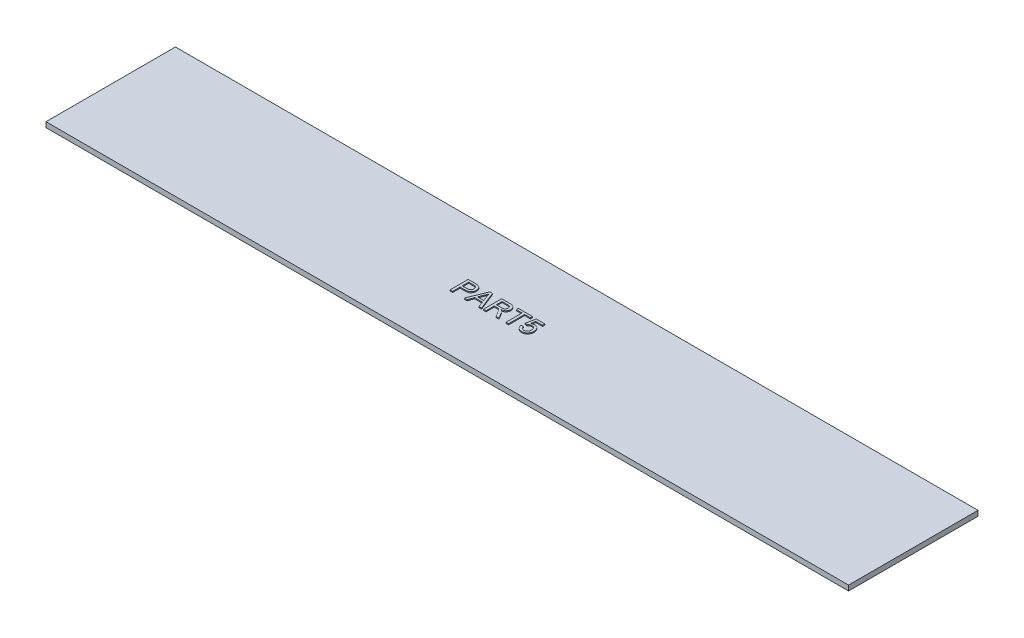
from build123d import *

# Parameters (mm, degrees)
SKETCH_1_W      = 155
SKETCH_1_H      = 25
EXTRUDE_1_DEPTH = 1
EXTRUDE_2_DEPTH = 0.2


with BuildPart() as part:
    # 草图1 → 凸台-拉伸1 (new body)
    with BuildSketch(Plane(origin=(0, 0, 0), x_dir=(1, 0, 0), z_dir=(0, 1, 0))):
        with Locations((77.5, 12.5)):
            Rectangle(SKETCH_1_W, SKETCH_1_H)
    extrude(amount=EXTRUDE_1_DEPTH)

    # 草图2 → 凸台-拉伸2 (add)
    # profile 1 of 5: a face of its own
    with BuildSketch(Plane(origin=(0, 1, 0), x_dir=(1, 0, 0), z_dir=(0, 1, 0))):
        with BuildLine():
            Line((67.347806696, 10.693449152), (67.347806696, 14.193449152))
            Line((67.347806696, 14.193449152), (68.633664068, 14.193449152))
            add(Edge.make_bspline(
                [(68.633664068, 14.193449152), (68.68696182, 14.19314551), (68.787055247, 14.19257527), (68.926834433, 14.185897021), (69.046865089, 14.177634922), (69.119364088, 14.165871841), (69.152494196, 14.160496427)],
                knots=[0, 0, 0, 0, 1.22865052, 2.30741144, 3.226532197, 4, 4, 4, 4], degree=3))
            add(Edge.make_bspline(
                [(69.152494196, 14.160496427), (69.19290493, 14.152719291), (69.271232196, 14.137645034), (69.382131465, 14.101304269), (69.483167123, 14.056080961), (69.574181271, 13.999737386), (69.656685935, 13.933547467), (69.72950533, 13.854236406), (69.794054227, 13.76357508), (69.848940508, 13.661634426), (69.894624927, 13.551946326), (69.926622472, 13.435090545), (69.947116957, 13.313097294), (69.949274138, 13.229724292), (69.950370799, 13.187339376)],
                knots=[0, 0, 0, 0, 1.070909925, 2.075721949, 3.031861647, 3.947440733, 4.85625699, 5.777986723, 6.742441087, 7.747548058, 8.78749499, 9.830146138, 10.896896232, 12, 12, 12, 12], degree=3))
            add(Edge.make_bspline(
                [(69.950370799, 13.187339376), (69.949597936, 13.151074858), (69.948077287, 13.079722432), (69.935019715, 12.974895422), (69.9144251, 12.874047575), (69.883705439, 12.77786901), (69.846149829, 12.685235305), (69.798821082, 12.597708749), (69.743554458, 12.514100806), (69.68014649, 12.43463898), (69.605497702, 12.360935733), (69.515686032, 12.298413017), (69.412443059, 12.245911512), (69.295744703, 12.203490863), (69.165874252, 12.170112648), (69.022406181, 12.145656905), (68.86506101, 12.132155299), (68.755684558, 12.1303068), (68.698868395, 12.129346588)],
                knots=[0, 0, 0, 0, 0.928769099, 1.82740408, 2.702266355, 3.562020322, 4.410419678, 5.259600434, 6.10654066, 6.975254961, 7.860221694, 8.783881459, 9.766664779, 10.81996744, 11.958551584, 13.197863772, 14.544415867, 16, 16, 16, 16], degree=3))
            Line((68.698868395, 12.129346588), (67.84139644, 12.129346588))
            Line((67.84139644, 12.129346588), (67.84139644, 10.693449152))
            Line((67.84139644, 10.693449152), (67.347806696, 10.693449152))
        make_face()
        with BuildLine():
            Line((67.84139644, 12.533192741), (68.685547081, 12.533192741))
            add(Edge.make_bspline(
                [(68.685547081, 12.533192741), (68.719215125, 12.533755684), (68.784073493, 12.53484014), (68.877790877, 12.542408067), (68.96380031, 12.5555078), (69.042340375, 12.573778092), (69.113511078, 12.59648754), (69.177185081, 12.625208742), (69.233034037, 12.659661455), (69.281428015, 12.699494603), (69.322968784, 12.744117448), (69.358962872, 12.792798509), (69.389545395, 12.845885666), (69.41351848, 12.903601033), (69.433826987, 12.964821934), (69.446503162, 13.030816868), (69.455316867, 13.100628812), (69.456286149, 13.148747842), (69.456781055, 13.17331694)],
                knots=[0, 0, 0, 0, 1.403696362, 2.704090955, 3.91683431, 5.027708188, 6.063065288, 7.026749679, 7.932587242, 8.790956304, 9.632005367, 10.468072405, 11.310475089, 12.179234342, 13.069796908, 13.994719932, 14.976123913, 16, 16, 16, 16], degree=3))
            add(Edge.make_bspline(
                [(69.456781055, 13.17331694), (69.455735499, 13.208946052), (69.453709576, 13.27798283), (69.433297895, 13.377324628), (69.401296692, 13.46911821), (69.355480387, 13.551625636), (69.300029331, 13.624006624), (69.234847789, 13.683226186), (69.162025501, 13.730570043), (69.107652917, 13.749315902), (69.080278651, 13.758753639)],
                knots=[0, 0, 0, 0, 1.143156811, 2.215038775, 3.243253804, 4.254666983, 5.233799895, 6.158487526, 7.072877374, 8, 8, 8, 8], degree=3))
            add(Edge.make_bspline(
                [(69.080278651, 13.758753639), (69.070253318, 13.761205054), (69.048467579, 13.766532149), (69.012379672, 13.772578482), (68.970555691, 13.778303822), (68.922791762, 13.782102318), (68.869523482, 13.785874709), (68.810588002, 13.787613687), (68.745851069, 13.789115668), (68.700739251, 13.789435592), (68.677133619, 13.789602998)],
                knots=[0, 0, 0, 0, 0.611063981, 1.327884044, 2.165719042, 3.110592661, 4.16481496, 5.328235826, 6.601947678, 8, 8, 8, 8], degree=3))
            Line((68.677133619, 13.789602998), (67.84139644, 13.789602998))
            Line((67.84139644, 13.789602998), (67.84139644, 12.533192741))
        make_face(mode=Mode.SUBTRACT)
    # profile 2 of 5: a face of its own
    with BuildSketch(Plane(origin=(0, 1, 0), x_dir=(1, 0, 0), z_dir=(0, 1, 0))):
        Polygon((70.100410863, 10.693449152), (71.490735382, 14.193449152), (72.046724965, 14.193449152), (73.436348363, 10.693449152), (72.91190926, 10.693449152), (72.513672081, 11.770372229), (71.022386023, 11.770372229), (70.623447722, 10.693449152), align=None)
        with BuildLine():
            Line((71.170322722, 12.174218382), (72.365735382, 12.174218382))
            Line((72.365735382, 12.174218382), (72.02499019, 13.094090177))
            add(Edge.make_bspline(
                [(72.02499019, 13.094090177), (72.011954114, 13.12963277), (71.986466125, 13.199125249), (71.948455854, 13.300091956), (71.913730283, 13.395974084), (71.879679009, 13.485396822), (71.848940316, 13.569659125), (71.820607675, 13.648191839), (71.792586932, 13.720449125), (71.77577129, 13.767134776), (71.767678491, 13.789602998)],
                knots=[0, 0, 0, 0, 1.225184869, 2.395467751, 3.491410812, 4.525364584, 5.492066482, 6.394148129, 7.227157926, 8, 8, 8, 8], degree=3))
            add(Edge.make_bspline(
                [(71.767678491, 13.789602998), (71.75429144, 13.734198342), (71.727462139, 13.623160579), (71.671288115, 13.460475361), (71.607026983, 13.299277972), (71.554839287, 13.195403475), (71.528595959, 13.143168703)],
                knots=[0, 0, 0, 0, 0.9891762, 1.982431084, 2.985436691, 4, 4, 4, 4], degree=3))
            Line((71.528595959, 13.143168703), (71.170322722, 12.174218382))
        make_face(mode=Mode.SUBTRACT)
    # profile 3 of 5: a face of its own
    with BuildSketch(Plane(origin=(0, 1, 0), x_dir=(1, 0, 0), z_dir=(0, 1, 0))):
        with BuildLine():
            Line((73.809345158, 10.693449152), (73.809345158, 14.193449152))
            Line((73.809345158, 14.193449152), (75.327974965, 14.193449152))
            add(Edge.make_bspline(
                [(75.327974965, 14.193449152), (75.363734047, 14.193168964), (75.432941565, 14.192626695), (75.533306755, 14.188788042), (75.626987599, 14.180512915), (75.714156344, 14.171564517), (75.794797502, 14.157829922), (75.868827879, 14.142076652), (75.936361773, 14.123330023), (75.997701102, 14.101188808), (76.054610625, 14.076139341), (76.107361453, 14.045232343), (76.158146372, 14.011364862), (76.205080575, 13.971575627), (76.249401957, 13.928010098), (76.29106944, 13.880076311), (76.329466169, 13.827358299), (76.376823936, 13.75190789), (76.427629164, 13.651423835), (76.4699579, 13.522826017), (76.497250711, 13.388308005), (76.50017112, 13.296380527), (76.50165285, 13.249739216)],
                knots=[0, 0, 0, 0, 1.242255013, 2.404239178, 3.487702428, 4.508875116, 5.447164253, 6.327763259, 7.137389581, 7.87956647, 8.591787438, 9.293660819, 10.000726923, 10.709654955, 11.427269343, 12.158170644, 12.913245971, 13.690346794, 15.251572448, 16.809945773, 18.381459854, 20, 20, 20, 20], degree=3))
            add(Edge.make_bspline(
                [(76.50165285, 13.249739216), (76.500967961, 13.219799653), (76.499615258, 13.160666964), (76.489253416, 13.073726083), (76.470504499, 12.990657568), (76.446462709, 12.910733918), (76.413556833, 12.835087525), (76.375436804, 12.762173288), (76.328211508, 12.693994355), (76.275337567, 12.628735231), (76.214705335, 12.567793592), (76.145781432, 12.513368062), (76.069249086, 12.46441219), (75.984747858, 12.422276685), (75.893250444, 12.383762834), (75.793608802, 12.352749625), (75.686225077, 12.327424962), (75.611781688, 12.315161783), (75.573367594, 12.308833767)],
                knots=[0, 0, 0, 0, 0.982609109, 1.940720374, 2.867584677, 3.775009516, 4.675469332, 5.571146231, 6.471115823, 7.392408543, 8.32534739, 9.286126426, 10.269214477, 11.301811357, 12.381622301, 13.524260118, 14.722474812, 16, 16, 16, 16], degree=3))
            add(Edge.make_bspline(
                [(75.573367594, 12.308833767), (75.601545787, 12.294598765), (75.655057191, 12.267565984), (75.729144392, 12.225178819), (75.791945548, 12.181869581), (75.82832944, 12.150893541), (75.84540285, 12.136357806)],
                knots=[0, 0, 0, 0, 1.172304973, 2.226249348, 3.167654437, 4, 4, 4, 4], degree=3))
            add(Edge.make_bspline(
                [(75.84540285, 12.136357806), (75.878466472, 12.103945794), (75.9463815, 12.037369219), (76.03997136, 11.923969809), (76.130709943, 11.797738865), (76.185840473, 11.706511333), (76.214192914, 11.659594985)],
                knots=[0, 0, 0, 0, 0.918110279, 1.885863737, 2.912745394, 4, 4, 4, 4], degree=3))
            Line((76.214192914, 11.659594985), (76.788411664, 10.693449152))
            Line((76.788411664, 10.693449152), (76.222606376, 10.693449152))
            Line((76.222606376, 10.693449152), (75.786508619, 11.432431523))
            add(Edge.make_bspline(
                [(75.786508619, 11.432431523), (75.770828734, 11.458359608), (75.740443692, 11.508603979), (75.696553587, 11.581983464), (75.653520783, 11.649540972), (75.613608592, 11.713207333), (75.575197313, 11.771826715), (75.538658087, 11.825602752), (75.50499649, 11.875240914), (75.463302251, 11.933032652), (75.414777082, 11.996979747), (75.358151539, 12.062833179), (75.304227233, 12.115337243), (75.237818455, 12.166823063), (75.155561137, 12.214979393), (75.085640864, 12.237105904), (75.051732978, 12.247836171)],
                knots=[0, 0, 0, 0, 1.130940588, 2.191577161, 3.191089816, 4.120344442, 4.99615009, 5.80661983, 6.546979556, 7.234477901, 8.466216387, 9.541989141, 10.473533583, 11.269175393, 12.675684693, 14, 14, 14, 14], degree=3))
            add(Edge.make_bspline(
                [(75.051732978, 12.247836171), (75.037506486, 12.250401691), (75.005026978, 12.25625885), (74.949876855, 12.26008417), (74.883055715, 12.264144235), (74.834629296, 12.264025939), (74.808443715, 12.263961972)],
                knots=[0, 0, 0, 0, 0.709978628, 1.620902492, 2.713552433, 4, 4, 4, 4], degree=3))
            Line((74.808443715, 12.263961972), (74.302934901, 12.263961972))
            Line((74.302934901, 12.263961972), (74.302934901, 10.693449152))
            Line((74.302934901, 10.693449152), (73.809345158, 10.693449152))
        make_face()
        with BuildLine():
            Line((74.302934901, 12.667808126), (75.240334741, 12.667808126))
            add(Edge.make_bspline(
                [(75.240334741, 12.667808126), (75.28733952, 12.66854356), (75.375210545, 12.669918386), (75.498084272, 12.681657951), (75.602800027, 12.700312618), (75.691427891, 12.727522635), (75.765889287, 12.765299174), (75.830649777, 12.811336946), (75.884466559, 12.869004048), (75.929236563, 12.934069095), (75.964037206, 13.005669932), (75.989140729, 13.080876113), (76.005571422, 13.15905558), (76.007225189, 13.212263442), (76.008063106, 13.239222389)],
                knots=[0, 0, 0, 0, 1.546323217, 2.890706218, 4.056530419, 5.041445823, 5.928701482, 6.793137403, 7.641659452, 8.509781392, 9.383301667, 10.251423607, 11.114044887, 12, 12, 12, 12], degree=3))
            add(Edge.make_bspline(
                [(76.008063106, 13.239222389), (76.00741166, 13.258868399), (76.006135669, 13.29734916), (75.999446501, 13.353828234), (75.98644117, 13.40749641), (75.969267663, 13.458637382), (75.946320372, 13.50687658), (75.919059926, 13.552587804), (75.886529799, 13.595517705), (75.84926841, 13.635797053), (75.806485564, 13.672447323), (75.757617496, 13.704068557), (75.703049626, 13.730939784), (75.642718526, 13.752266586), (75.576814252, 13.769324557), (75.504961624, 13.780672674), (75.427489241, 13.788884134), (75.373805372, 13.7893589), (75.346204132, 13.789602998)],
                knots=[0, 0, 0, 0, 0.965208469, 1.890559848, 2.786986821, 3.67262109, 4.535197034, 5.405224191, 6.282113641, 7.175449223, 8.095446547, 9.040936516, 10.026471658, 11.075712529, 12.17809725, 13.364958037, 14.645208957, 16, 16, 16, 16], degree=3))
            Line((75.346204132, 13.789602998), (74.302934901, 13.789602998))
            Line((74.302934901, 13.789602998), (74.302934901, 12.667808126))
        make_face(mode=Mode.SUBTRACT)
    # profile 4 of 5: a face of its own
    with BuildSketch(Plane(origin=(0, 1, 0), x_dir=(1, 0, 0), z_dir=(0, 1, 0))):
        Polygon((78.16190926, 10.693449152), (78.16190926, 13.789602998), (77.040114388, 13.789602998), (77.040114388, 14.193449152), (79.777293876, 14.193449152), (79.777293876, 13.789602998), (78.655499004, 13.789602998), (78.655499004, 10.693449152), align=None)
    # profile 5 of 5: a face of its own
    with BuildSketch(Plane(origin=(0, 1, 0), x_dir=(1, 0, 0), z_dir=(0, 1, 0))):
        with BuildLine():
            Line((80.136268235, 11.635756844), (80.584986183, 11.680628639))
            add(Edge.make_bspline(
                [(80.584986183, 11.680628639), (80.589429195, 11.655345845), (80.598071545, 11.606166879), (80.614540497, 11.534978867), (80.635928979, 11.468843214), (80.659961292, 11.407187148), (80.688527751, 11.350662604), (80.719479745, 11.298377089), (80.755981297, 11.252186576), (80.794357779, 11.209675258), (80.836478899, 11.172215269), (80.882751096, 11.140635205), (80.931883345, 11.113083512), (80.984474058, 11.09052541), (81.040603836, 11.074014067), (81.099558298, 11.060956429), (81.162096589, 11.054376747), (81.204766038, 11.053082915), (81.226512626, 11.052423511)],
                knots=[0, 0, 0, 0, 1.237781394, 2.407677316, 3.51963579, 4.58689595, 5.594855907, 6.570874, 7.510833816, 8.428091223, 9.330271693, 10.221190844, 11.124215526, 12.043132878, 12.973586933, 13.941700858, 14.950982896, 16, 16, 16, 16], degree=3))
            add(Edge.make_bspline(
                [(81.226512626, 11.052423511), (81.253190816, 11.053068133), (81.305361181, 11.054328721), (81.381259179, 11.064990263), (81.452950985, 11.082569911), (81.520093564, 11.107171322), (81.583474034, 11.137766088), (81.640989785, 11.177380737), (81.695776894, 11.221911516), (81.744309797, 11.275000752), (81.788488375, 11.332797253), (81.826617809, 11.395884592), (81.858717405, 11.463377289), (81.885741757, 11.535262404), (81.905697269, 11.611950591), (81.920376159, 11.693033885), (81.929799421, 11.778563935), (81.930686823, 11.837187378), (81.931140029, 11.867127036)],
                knots=[0, 0, 0, 0, 1.052816602, 2.058828735, 3.018813999, 3.961574988, 4.877590722, 5.788574389, 6.712363302, 7.658909047, 8.620312049, 9.580784896, 10.562948504, 11.56722449, 12.607883026, 13.686460295, 14.818448981, 16, 16, 16, 16], degree=3))
            add(Edge.make_bspline(
                [(81.931140029, 11.867127036), (81.930624922, 11.895659141), (81.92962189, 11.951217765), (81.921174718, 12.03212036), (81.906923344, 12.108193282), (81.888483401, 12.180274989), (81.863066266, 12.247239114), (81.832920112, 12.310056572), (81.795989807, 12.367394192), (81.754902405, 12.421037259), (81.707975405, 12.469126107), (81.654574831, 12.509731049), (81.596795555, 12.545268573), (81.533473845, 12.574087288), (81.464572412, 12.59549851), (81.390775948, 12.611972519), (81.311318705, 12.620637173), (81.256678815, 12.622156177), (81.228615991, 12.622936331)],
                knots=[0, 0, 0, 0, 1.165854935, 2.270189951, 3.319242023, 4.32700288, 5.306253956, 6.24172124, 7.169108591, 8.088047231, 8.999810445, 9.905349262, 10.822648491, 11.767237767, 12.739852311, 13.766490849, 14.852878837, 16, 16, 16, 16], degree=3))
            add(Edge.make_bspline(
                [(81.228615991, 12.622936331), (81.193721231, 12.621915591), (81.126800979, 12.619958043), (81.030643457, 12.603489892), (80.943107784, 12.576887692), (80.865185035, 12.537240349), (80.79556491, 12.489875086), (80.732801087, 12.436279141), (80.676376015, 12.376488752), (80.645424566, 12.331473528), (80.629857978, 12.308833767)],
                knots=[0, 0, 0, 0, 1.182877094, 2.268490576, 3.298955169, 4.273890847, 5.221533034, 6.149304476, 7.069219215, 8, 8, 8, 8], degree=3))
            Line((80.629857978, 12.308833767), (80.181140029, 12.353705562))
            Line((80.181140029, 12.353705562), (80.540114388, 14.148577357))
            Line((80.540114388, 14.148577357), (82.200370799, 14.148577357))
            Line((82.200370799, 14.148577357), (82.200370799, 13.699859408))
            Line((82.200370799, 13.699859408), (80.906801087, 13.699859408))
            Line((80.906801087, 13.699859408), (80.728015029, 12.793308927))
            add(Edge.make_bspline(
                [(80.728015029, 12.793308927), (80.752774084, 12.811888469), (80.801396951, 12.84837575), (80.877239908, 12.896151035), (80.95416734, 12.936422414), (81.031731432, 12.969401287), (81.11054831, 12.995091772), (81.190142356, 13.012940334), (81.270784574, 13.025003442), (81.324859938, 13.02618778), (81.352013427, 13.026782485)],
                knots=[0, 0, 0, 0, 1.093835215, 2.148119334, 3.164235237, 4.159999629, 5.123971815, 6.089888814, 7.040853737, 8, 8, 8, 8], degree=3))
            add(Edge.make_bspline(
                [(81.352013427, 13.026782485), (81.387351859, 13.025856595), (81.456941801, 13.024033294), (81.559484879, 13.009052422), (81.657533744, 12.983621796), (81.751855443, 12.949369085), (81.841213779, 12.903966323), (81.92648526, 12.848974472), (82.007435344, 12.784027552), (82.083290198, 12.709908591), (82.153251182, 12.628761236), (82.213768896, 12.540409649), (82.265389898, 12.446552945), (82.307403378, 12.346925651), (82.339826433, 12.241417182), (82.362605137, 12.130598741), (82.37708338, 12.014041462), (82.378918851, 11.934478431), (82.379857978, 11.893769665)],
                knots=[0, 0, 0, 0, 0.991768597, 1.953032897, 2.901448806, 3.831393711, 4.764457888, 5.708985199, 6.675229655, 7.672775783, 8.682587987, 9.678060661, 10.67346847, 11.684877956, 12.707987765, 13.766988156, 14.857469887, 16, 16, 16, 16], degree=3))
            add(Edge.make_bspline(
                [(82.379857978, 11.893769665), (82.37906348, 11.854941158), (82.377494119, 11.778243777), (82.364632883, 11.665216008), (82.343447053, 11.556304855), (82.315085072, 11.451187801), (82.27676423, 11.350461828), (82.230284635, 11.253801583), (82.176667816, 11.160198449), (82.133669909, 11.102497519), (82.112029453, 11.073457165)],
                knots=[0, 0, 0, 0, 1.059692978, 2.093196008, 3.100373587, 4.086253034, 5.061402885, 6.037282833, 7.012182238, 8, 8, 8, 8], degree=3))
            add(Edge.make_bspline(
                [(82.112029453, 11.073457165), (82.084535859, 11.039557931), (82.030453009, 10.972874499), (81.936809144, 10.886323395), (81.836140661, 10.812766868), (81.72784847, 10.753007521), (81.612659573, 10.704985825), (81.489158903, 10.67302919), (81.358838755, 10.651569043), (81.269371446, 10.649588307), (81.223708138, 10.648577357)],
                knots=[0, 0, 0, 0, 1.023140956, 2.012628108, 2.982342558, 3.942221589, 4.908720554, 5.902469194, 6.929439212, 8, 8, 8, 8], degree=3))
            add(Edge.make_bspline(
                [(81.223708138, 10.648577357), (81.186043155, 10.649341385), (81.112362886, 10.650835977), (81.004481863, 10.663829254), (80.901874254, 10.684548949), (80.804507912, 10.714267406), (80.712089499, 10.751819458), (80.625693259, 10.79952344), (80.543819878, 10.854093825), (80.468270298, 10.917211915), (80.399434793, 10.98761285), (80.337756784, 11.063804988), (80.28407094, 11.14583801), (80.238403173, 11.23322105), (80.200341199, 11.325870304), (80.171222283, 11.424418139), (80.148157679, 11.527897648), (80.140272937, 11.599426802), (80.136268235, 11.635756844)],
                knots=[0, 0, 0, 0, 1.108768375, 2.168973506, 3.19473529, 4.187459816, 5.162590879, 6.12651078, 7.088512529, 8.056012598, 9.019588496, 9.983680353, 10.938070192, 11.90157236, 12.88306954, 13.882379887, 14.924449348, 16, 16, 16, 16], degree=3))
        make_face()
    extrude(amount=EXTRUDE_2_DEPTH)


solid = part.part
